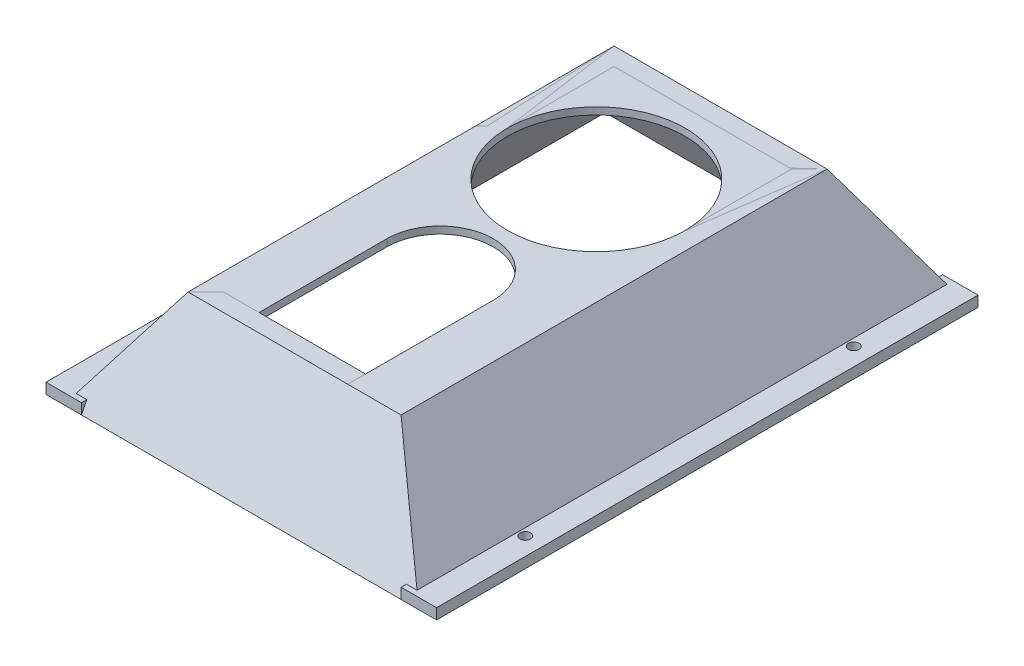
from build123d import *

# Parameters (mm, degrees)
SKETCH6_W             = 10
SKETCH6_H             = 152.5
BOSS_EXTRUDE2_DEPTH   = 3
F_3_0MM_DOWEL_HOLE1_D = 3
SKETCH12_R            = 25
BOSS_EXTRUDE3_DEPTH   = 2


with BuildPart() as part:
    # Sketch1 → Loft8 section 0
    with BuildSketch(Plane(origin=(0, 0, 0), x_dir=(1, 0, 0), z_dir=(0, 1, 0))):
        with BuildLine():
            Line((-50, 152.5), (50, 152.5))
            Line((50, 152.5), (50, 0))
            Line((50, 0), (-50, 0))
            Line((-50, 0), (-50, 152.5))
        make_face()
    # Sketch3 → Loft8 section 1
    with BuildSketch(Plane(origin=(0, 30, 0), x_dir=(1, 0, 0), z_dir=(0, 1, 0))):
        with BuildLine():
            Line((-30, 135), (30, 135))
            Line((30, 135), (30, 15))
            Line((30, 15), (-30, 15))
            Line((-30, 15), (-30, 135))
        make_face()
    loft()

    # Sketch4 → Cut-Loft1 section 0
    with BuildSketch(Plane(origin=(0, 30, 0), x_dir=(1, 0, 0), z_dir=(0, 1, 0))):
        with BuildLine():
            Line((-25, 130), (25, 130))
            Line((25, 130), (25, 20))
            Line((25, 20), (-25, 20))
            Line((-25, 20), (-25, 130))
        make_face()
    # Sketch5 → Cut-Loft1 section 1
    with BuildSketch(Plane(origin=(0, 0, 0), x_dir=(1, 0, 0), z_dir=(0, 1, 0))):
        with BuildLine():
            Line((-45, 147.5), (45, 147.5))
            Line((45, 147.5), (45, 5))
            Line((45, 5), (-45, 5))
            Line((-45, 5), (-45, 147.5))
        make_face()
    loft(mode=Mode.SUBTRACT)

    # Sketch6 → Boss-Extrude2 (add)
    with BuildSketch(Plane(origin=(0, 0, 0), x_dir=(1, 0, 0), z_dir=(0, 1, 0))):
        with Locations((-50, 76.25)):
            Rectangle(SKETCH6_W, SKETCH6_H)
        with Locations((50, 76.25)):
            Rectangle(SKETCH6_W, SKETCH6_H)
    extrude(amount=BOSS_EXTRUDE2_DEPTH)

    # Ø3.0mm Dowel Hole1 (through all)
    with Locations(Plane(origin=(0, 3, 0), x_dir=(1, 0, 0), z_dir=(0, 1, 0))):
        with Locations((50, 30), (-50, 30), (-50, 122.5), (50, 122.5)):
            Hole(F_3_0MM_DOWEL_HOLE1_D / 2)


with BuildPart() as body_2:
    # Sketch12 → Boss-Extrude3 (new body)
    with BuildSketch(Plane(origin=(0, 30, 0), x_dir=(1, 0, 0), z_dir=(0, 1, 0))):
        with BuildLine():
            Line((-15, 15), (-15, 56))
            ThreePointArc((-15, 56), (0, 71), (15, 56))
            Line((15, 56), (15, 15))
            Line((15, 15), (30, 15))
            Line((30, 15), (30, 135))
            Line((30, 135), (-30, 135))
            Line((-30, 135), (-30, 15))
            Line((-30, 15), (-15, 15))
        make_face()
        with Locations(Location((0, 100, 0), (0, 0, 270))):
            Circle(SKETCH12_R, mode=Mode.SUBTRACT)
    extrude(amount=-BOSS_EXTRUDE3_DEPTH)


solid = Compound([part.part, body_2.part])
